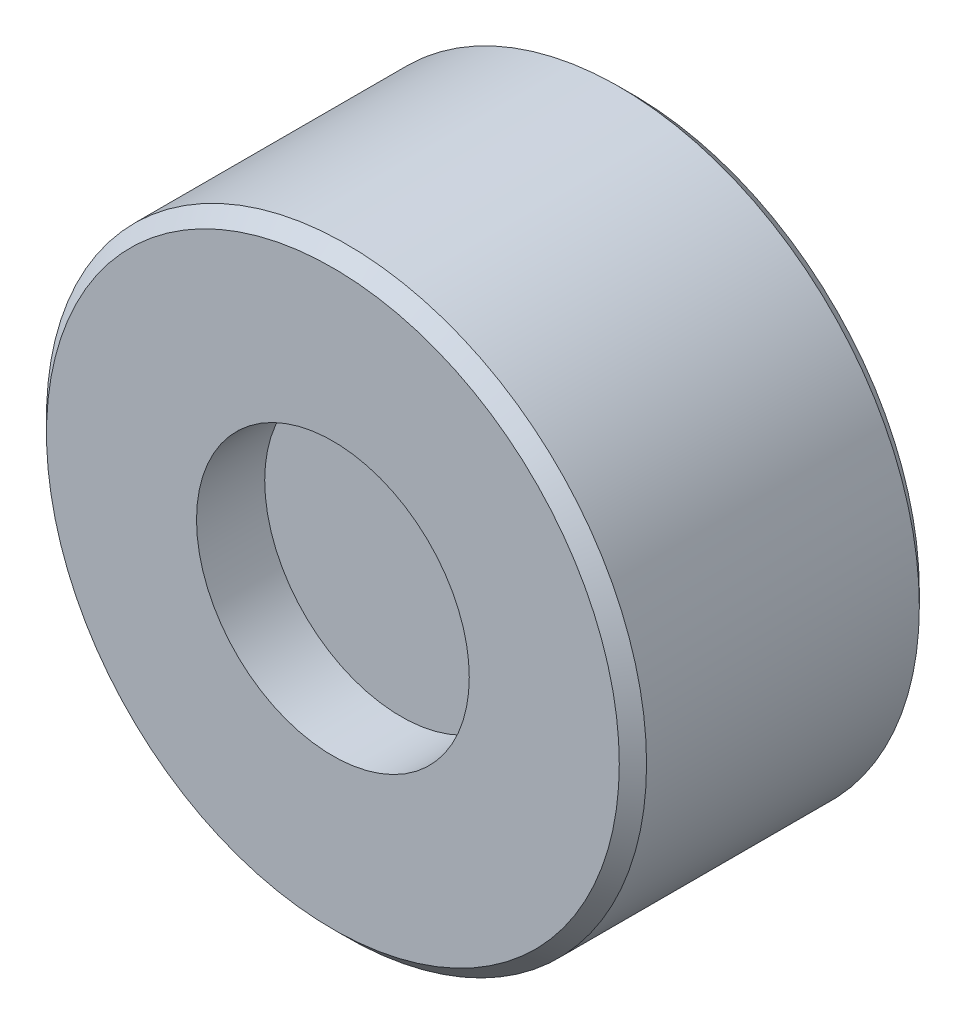
from build123d import *

# Parameters (mm, degrees)
SKETCH_1_R          = 22
EXTRUDE_1_DEPTH     = 22
SKETCH_2_R          = 10
CUT_EXTRUDE_1_DEPTH = 5
CHAMFER_1_SIZE      = 1
SKETCH_3_R          = 0.911044844
CUT_EXTRUDE_2_DEPTH = 1
CHAMFER_2_SIZE      = 0.9


with BuildPart() as part:
    # 草图1 → 凸台-拉伸1 (new body)
    with BuildSketch(Plane.XY):
        Circle(SKETCH_1_R)
    extrude(amount=EXTRUDE_1_DEPTH)

    # 草图2 → 切除-拉伸1 (cut)
    with BuildSketch(Plane.XY.offset(22)):
        Circle(SKETCH_2_R)
    extrude(amount=-CUT_EXTRUDE_1_DEPTH, mode=Mode.SUBTRACT)

    # 倒角1
    chamfer_1_edges = [part.edges().sort_by_distance(p)[0] for p in [
        (-22, 0, 0),
        (-22, 0, 22),
    ]]
    chamfer(chamfer_1_edges, length=CHAMFER_1_SIZE)

    # 草图3 → 切除-拉伸2 (cut)
    with BuildSketch(Plane(origin=(0, 0, 0), x_dir=(-1, 0, 0), z_dir=(0, 0, -1))):
        with Locations((0, 18.818302181)):
            Circle(SKETCH_3_R)
    extrude(amount=-CUT_EXTRUDE_2_DEPTH, mode=Mode.SUBTRACT)

    # 倒角2
    chamfer_2_edges = [part.edges().sort_by_distance(p)[0] for p in [
        (0.911044844, 18.818302181, 1),
    ]]
    chamfer(chamfer_2_edges, length=CHAMFER_2_SIZE)


solid = part.part
